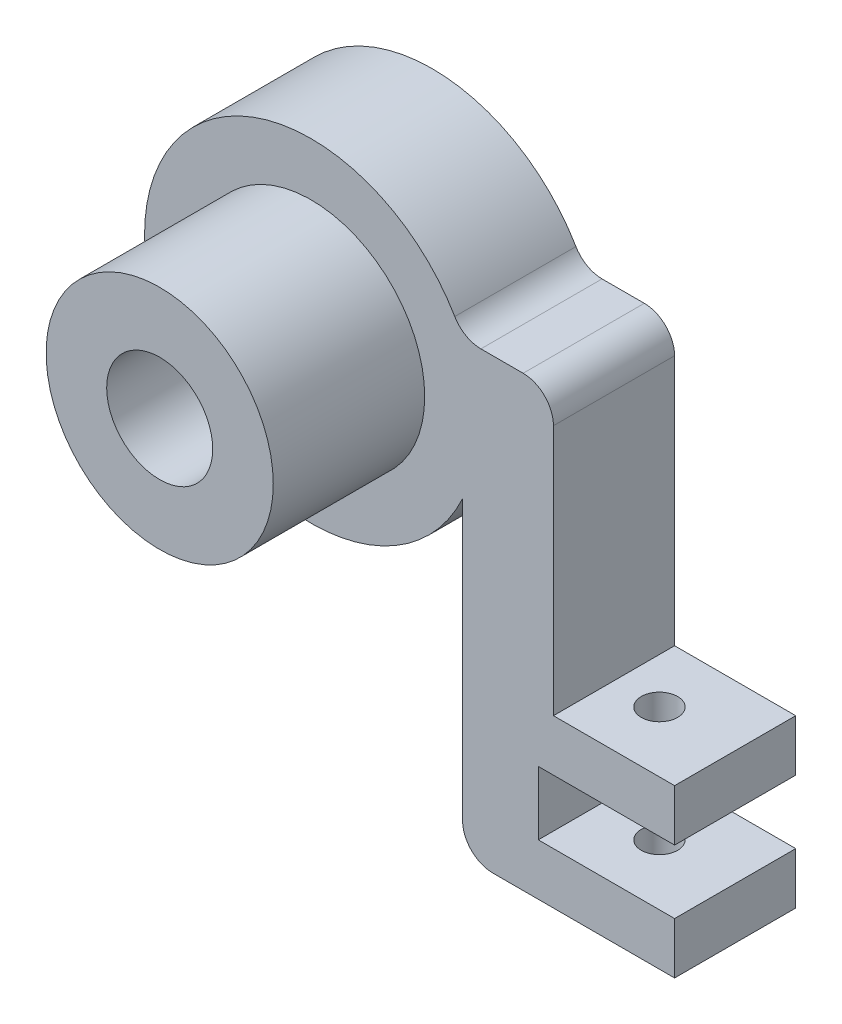
from build123d import *

# Parameters (mm, degrees)
BOSS_EXTRU_1_DEPTH      = 8
ENL_V_MAT_EXTRU_1_REACH = 45.749
ESQUISSE2_R             = 1
D_GAGEMENT_M21_D        = 2.4
D_GAGEMENT_M21_DEPTH    = 11
D_GAGEMENT_M21_TIP      = 0.721032743
CONG_1_R                = 2
ESQUISSE5_R             = 7.5
BOSS_EXTRU_2_DEPTH      = 10
ESQUISSE6_R             = 1
ENL_V_MAT_EXTRU_2_DEPTH = 6
ESQUISSE8_R             = 3.5
ENL_V_MAT_EXTRU_3_DEPTH = 18


with BuildPart() as part:
    # Esquisse1 → Boss.-Extru.1 (new body)
    with BuildSketch(Plane.XY):
        with BuildLine():
            Line((21, -6.417424305), (27, -6.417424305))
            Line((27, -6.417424305), (27, -25))
            Line((27, -25), (35, -25))
            Line((35, -25), (35, -28.4))
            Line((35, -28.4), (26, -28.4))
            Line((26, -28.4), (26, -32.6))
            Line((26, -32.6), (35, -32.6))
            Line((35, -32.6), (35, -36))
            Line((35, -36), (21, -36))
            Line((21, -36), (21, -15.582575695))
            ThreePointArc((21, -15.582575695), (0, -11), (21, -6.417424305))
        make_face()
    extrude(amount=BOSS_EXTRU_1_DEPTH)

    # Enlèv. mat.-Extru.1: up to this face of the body (flat: up to its plane)
    enl_v_mat_extru_1_end = Plane(part.part.faces().sort_by_distance((28, -36, 4))[0])
    # Esquisse2 → Enlèv. mat.-Extru.1 (cut, up to the picked face)
    with BuildSketch(Plane(origin=(0, -25, 0), x_dir=(1, 0, 0), z_dir=(0, 1, 0)), mode=Mode.PRIVATE) as enl_v_mat_extru_1_sk1:
        with Locations(Location((30, -4, 0), (0, 0, 270))):
            Circle(ESQUISSE2_R)
    enl_v_mat_extru_1_tool1 = split(extrude(enl_v_mat_extru_1_sk1.sketch, amount=-ENL_V_MAT_EXTRU_1_REACH, mode=Mode.PRIVATE), bisect_by=enl_v_mat_extru_1_end, keep=Keep.BOTH, mode=Mode.PRIVATE)
    add(enl_v_mat_extru_1_tool1.solids().sort_by(Axis((30, -25, 4), (0, -1, 0)))[0], mode=Mode.SUBTRACT)

    # Dégagement M21
    with Locations(Plane(origin=(0, -25, 0), x_dir=(1, 0, 0), z_dir=(0, 1, 0))):
        with Locations((30, -4)):
            Hole(D_GAGEMENT_M21_D / 2, depth=D_GAGEMENT_M21_DEPTH)
            with Locations((0, 0, -(D_GAGEMENT_M21_DEPTH + D_GAGEMENT_M21_TIP / 2))):  # 118° drill point
                Cone(0, D_GAGEMENT_M21_D / 2, D_GAGEMENT_M21_TIP, mode=Mode.SUBTRACT)

    # Congé1
    cong_1_edges = [part.edges().sort_by_distance(p)[0] for p in [
        (21, -36, 4),
        (21, -6.417424305, 4),
        (27, -6.417424305, 4),
    ]]
    fillet(cong_1_edges, radius=CONG_1_R)

    # Esquisse5 → Boss.-Extru.2 (add)
    with BuildSketch(Plane.XY.offset(8)):
        with Locations((11, -11)):
            Circle(ESQUISSE5_R)
    extrude(amount=BOSS_EXTRU_2_DEPTH)

    # Esquisse6 → Enlèv. mat.-Extru.2 (cut)
    with BuildSketch(Plane(origin=(0, 0, 0), x_dir=(-1, 0, 0), z_dir=(0, 0, -1))):
        with Locations((-11, -3.5)):
            Circle(ESQUISSE6_R)
        with Locations((-11, -18.5)):
            Circle(ESQUISSE6_R)
    extrude(amount=-ENL_V_MAT_EXTRU_2_DEPTH, mode=Mode.SUBTRACT)

    # Esquisse8 → Enlèv. mat.-Extru.3 (cut)
    with BuildSketch(Plane(origin=(0, 0, 0), x_dir=(-1, 0, 0), z_dir=(0, 0, -1))):
        with Locations((-11, -11)):
            Circle(ESQUISSE8_R)
    extrude(amount=-ENL_V_MAT_EXTRU_3_DEPTH, mode=Mode.SUBTRACT)


solid = part.part
